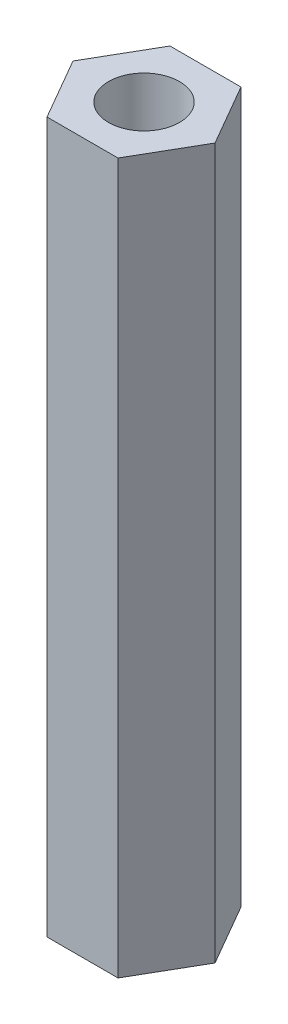
from build123d import *

# Parameters (mm, degrees)
SKETCH1_R           = 1.5
BOSS_EXTRUDE1_DEPTH = 30


with BuildPart() as part:
    # Sketch1 → Boss-Extrude1 (new body)
    with BuildSketch(Plane(origin=(0, 0, 0), x_dir=(1, 0, 0), z_dir=(0, 1, 0))):
        Polygon((1.5, 2.598076211), (-1.5, 2.598076211), (-3, 0), (-1.5, -2.598076211), (1.5, -2.598076211), (3, 0), align=None)
        Circle(SKETCH1_R, mode=Mode.SUBTRACT)
    extrude(amount=BOSS_EXTRUDE1_DEPTH)


solid = part.part
